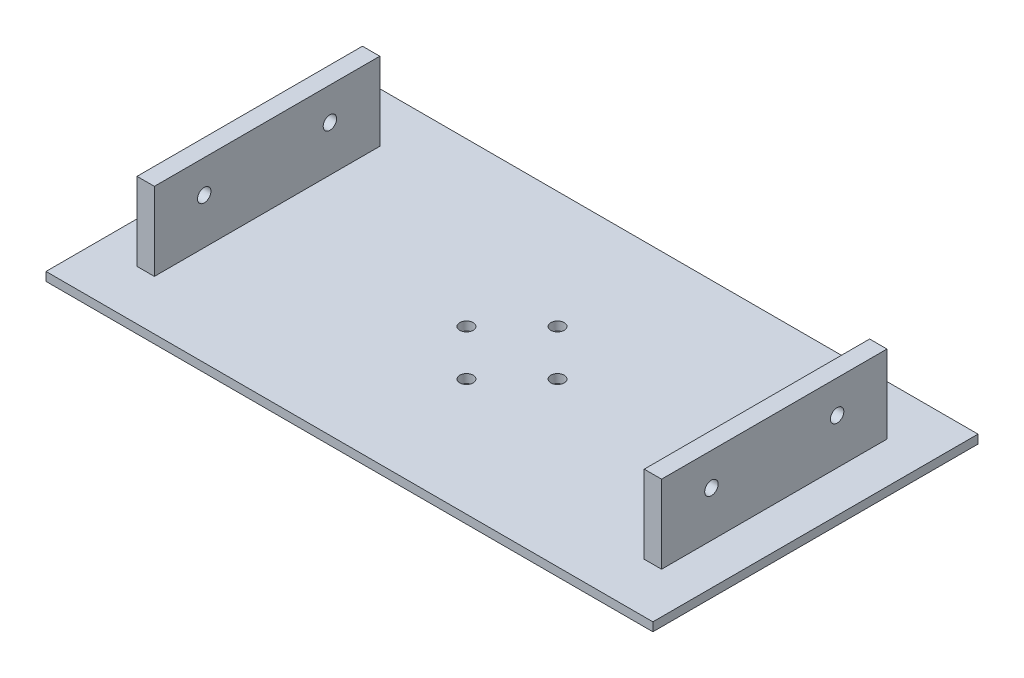
from build123d import *

# Parameters (mm, degrees)
SKETCH_1_W          = 140
SKETCH_1_H          = 75
EXTRUDE_1_DEPTH     = 2
SKETCH_2_W          = 4
SKETCH_2_H          = 52
EXTRUDE_2_DEPTH     = 18
SKETCH_3_R          = 1.55
CUT_EXTRUDE_1_DEPTH = 15
SKETCH_5_R          = 1.55
CUT_EXTRUDE_2_DEPTH = 15


with BuildPart() as part:
    # 草图1 → 凸台-拉伸1 (new body)
    with BuildSketch(Plane(origin=(0, 0, 0), x_dir=(1, 0, 0), z_dir=(0, 1, 0))):
        Rectangle(SKETCH_1_W, SKETCH_1_H)
    extrude(amount=EXTRUDE_1_DEPTH)

    # 草图2 → 凸台-拉伸2 (add)
    with BuildSketch(Plane(origin=(0, 2, 0), x_dir=(1, 0, 0), z_dir=(0, 1, 0))):
        with Locations((58.5, 0)):
            Rectangle(SKETCH_2_W, SKETCH_2_H)
        with Locations((-58.5, 0)):
            Rectangle(SKETCH_2_W, SKETCH_2_H)
    extrude(amount=EXTRUDE_2_DEPTH)

    # 草图3 → 切除-拉伸1 (cut)
    with BuildSketch(Plane.ZY.offset(60.5)):
        with Locations((-14.5, 12.5)):
            Circle(SKETCH_3_R)
        with Locations((14.5, 12.5)):
            Circle(SKETCH_3_R)
    cut_extrude_1 = extrude(amount=-CUT_EXTRUDE_1_DEPTH, mode=Mode.SUBTRACT)

    # 镜向1: 切除-拉伸1 across plane
    add(cut_extrude_1.mirror(Plane(origin=(0, 0, 0), x_dir=(0, 0, 1), z_dir=(1, 0, 0))), mode=Mode.SUBTRACT)

    # 草图5 → 切除-拉伸2 (cut)
    with BuildSketch(Plane(origin=(0, 0, 0), x_dir=(-1, 0, 0), z_dir=(0, -1, 0))):
        with Locations(Location((0, -10.5, 0), (0, 0, 90))):
            Circle(SKETCH_5_R)
        with Locations(Location((-10.5, 0, 0), (0, 0, 90))):
            Circle(SKETCH_5_R)
        with Locations(Location((10.5, 0, 0), (0, 0, 90))):
            Circle(SKETCH_5_R)
        with Locations(Location((0, 10.5, 0), (0, 0, 90))):
            Circle(SKETCH_5_R)
    extrude(amount=-CUT_EXTRUDE_2_DEPTH, mode=Mode.SUBTRACT)


solid = part.part
